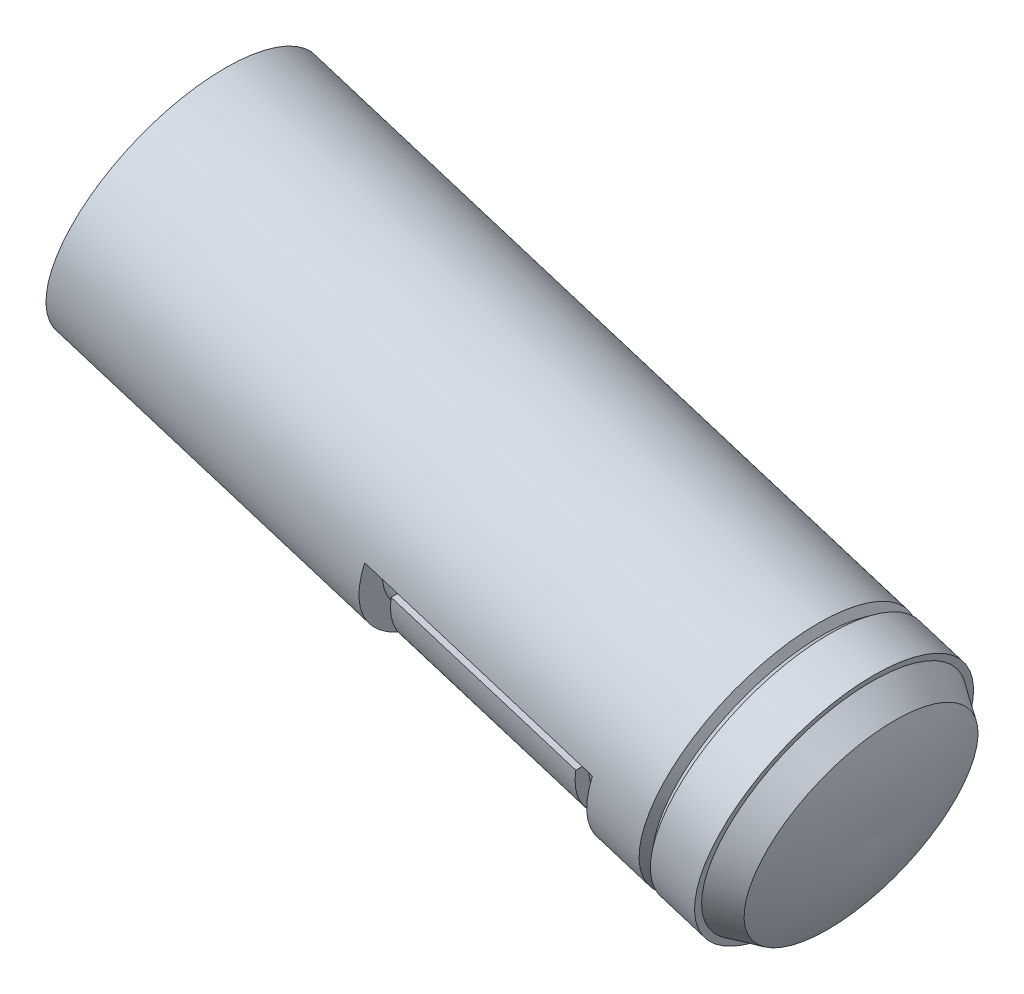
from build123d import *

# Parameters (mm, degrees)
CUT_EXTRUDE1_DEPTH  = 33.528
BOSS_EXTRUDE1_DEPTH = 27.178


with BuildPart() as part:
    # Sketch1 → Revolve1 (revolve)
    with BuildSketch(Plane.XY, mode=Mode.PRIVATE) as revolve1_sk:
        with BuildLine():
            Line((528.025465613, 124.987410399), (528.508452089, 123.740780169))
            Line((528.508452089, 123.740780169), (529.612965613, 124.494048207))
            Line((529.612965613, 124.494048207), (535.825761473, 122.563239653))
            Line((535.825761473, 122.563239653), (535.545433806, 121.661224501))
            Line((535.545433806, 121.661224501), (538.723236555, 118.483421752))
            ThreePointArc((538.723236555, 118.483421752), (537.998073772, 110.543513007), (535.87847289, 102.857466948))
            Line((535.87847289, 102.857466948), (530.245653628, 104.608030762))
            Line((530.245653628, 104.608030762), (439.077442195, 132.941226715))
            Line((439.077442195, 132.941226715), (444.657550041, 150.896435606))
            Line((444.657550041, 150.896435606), (528.025465613, 124.987410399))
        make_face()
    revolve(revolve1_sk.sketch.rotate(Axis((439.077442195, 132.941226715, 0), (0.9549466034375443, -0.29677766860580573, 0)), 180), axis=Axis((439.077442195, 132.941226715, 0), (0.9549466034375443, -0.29677766860580573, 0)))

    # Sketch3 → Cut-Extrude1 (cut)
    with BuildSketch(Plane(origin=(438.736808002, -136.350332617, 0), x_dir=(0, 0, -1), z_dir=(0.9549466034375443, -0.2967776686058057, 0))):
        with BuildLine():
            Line((-19.96170913, 257.260152541), (-15.627317141, 257.260152541))
            ThreePointArc((-15.627317141, 257.260152541), (0, 241.632835399), (15.627317141, 257.260152541))
            Line((15.627317141, 257.260152541), (19.96170913, 257.260152541))
            ThreePointArc((19.96170913, 257.260152541), (0, 237.298443411), (-19.96170913, 257.260152541))
        make_face()
    extrude(amount=-CUT_EXTRUDE1_DEPTH, mode=Mode.SUBTRACT)

    # Sketch4 → Boss-Extrude1 (add)
    with BuildSketch(Plane(origin=(435.704852536, -135.408063519, 0), x_dir=(0, 0, 1), z_dir=(-0.9549466034375443, 0.2967776686058057, 0))):
        with BuildLine():
            Line((17.171437949, 254.085152541), (-17.171437949, 254.085152541))
            ThreePointArc((-17.171437949, 254.085152541), (0, 239.797652541), (17.171437949, 254.085152541))
        make_face()
    extrude(amount=BOSS_EXTRUDE1_DEPTH)


solid = part.part
